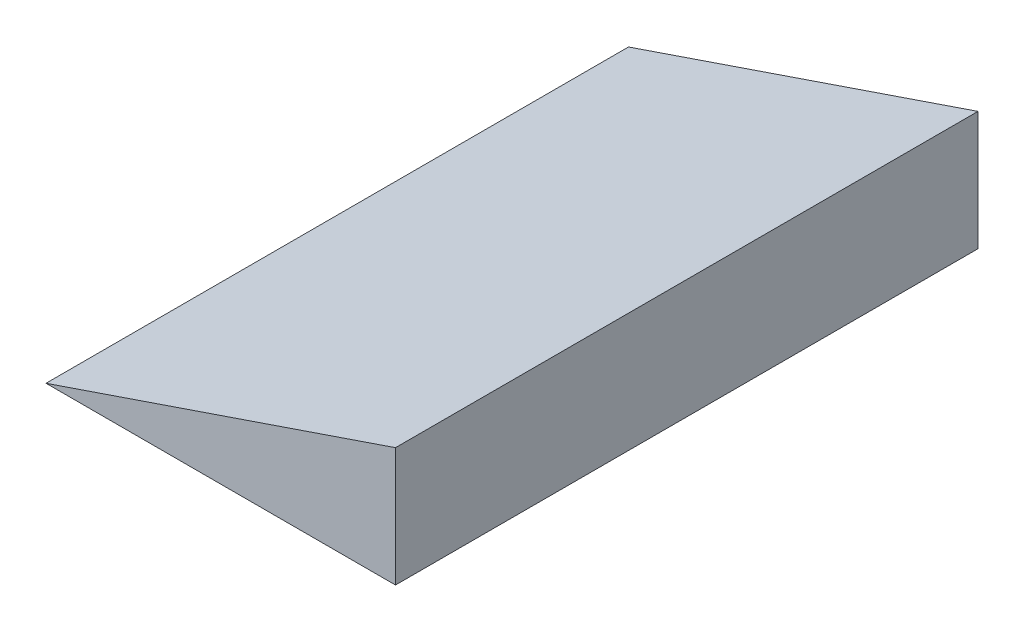
from build123d import *

# Parameters (mm, degrees)
BOSS_EXTRUDE1_DEPTH = 50


with BuildPart() as part:
    # Sketch1 → Boss-Extrude1 (new body)
    with BuildSketch(Plane.XY):
        Polygon((0, 0), (30, 0), (30, 10.212833057), align=None)
    extrude(amount=BOSS_EXTRUDE1_DEPTH)


solid = part.part
